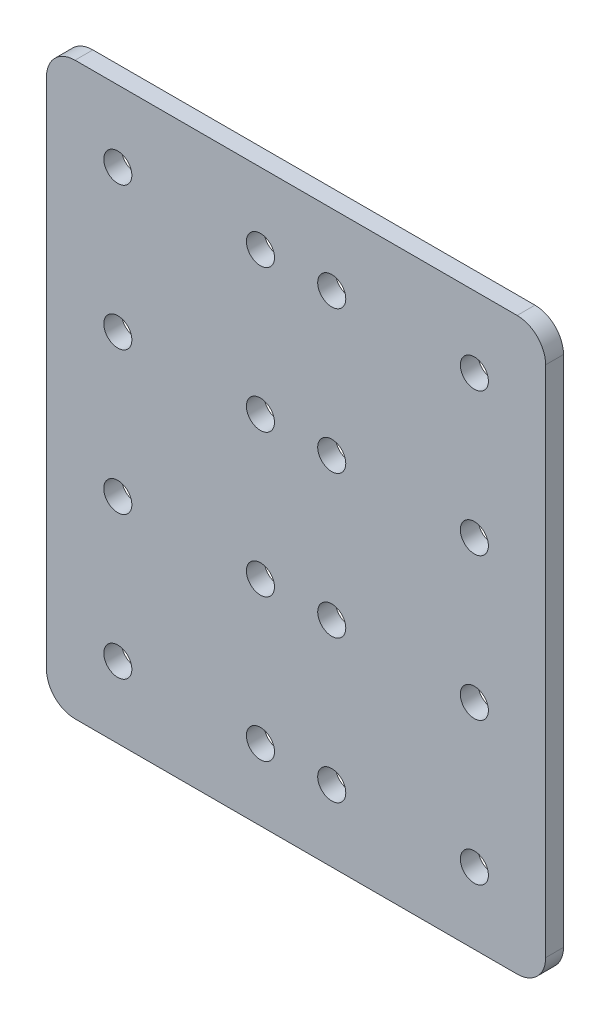
from build123d import *

# Parameters (mm, degrees)
SKETCH1_R           = 2.5
BOSS_EXTRUDE1_DEPTH = 3.175


with BuildPart() as part:
    # Sketch1 → Boss-Extrude1 (new body)
    with BuildSketch(Plane.XY):
        with BuildLine():
            Line((1176.02, 25.4), (1097.28, 25.4))
            ThreePointArc((1097.28, 25.4), (1093.687897552, 23.912102448), (1092.2, 20.32))
            Line((1092.2, 20.32), (1092.2, -71.12))
            ThreePointArc((1092.2, -71.12), (1093.687897552, -74.712102448), (1097.28, -76.2))
            Line((1097.28, -76.2), (1176.02, -76.2))
            ThreePointArc((1176.02, -76.2), (1179.612102448, -74.712102448), (1181.1, -71.12))
            Line((1181.1, -71.12), (1181.1, 20.32))
            ThreePointArc((1181.1, 20.32), (1179.612102448, 23.912102448), (1176.02, 25.4))
        make_face()
        with Locations((1143, 12.7)):
            Circle(SKETCH1_R, mode=Mode.SUBTRACT)
        with Locations((1168.4, 12.7)):
            Circle(SKETCH1_R, mode=Mode.SUBTRACT)
        with Locations((1168.4, -12.7)):
            Circle(SKETCH1_R, mode=Mode.SUBTRACT)
        with Locations((1168.4, -38.1)):
            Circle(SKETCH1_R, mode=Mode.SUBTRACT)
        with Locations((1168.4, -63.5)):
            Circle(SKETCH1_R, mode=Mode.SUBTRACT)
        with Locations((1143, -12.7)):
            Circle(SKETCH1_R, mode=Mode.SUBTRACT)
        with Locations((1143, -38.1)):
            Circle(SKETCH1_R, mode=Mode.SUBTRACT)
        with Locations((1143, -63.5)):
            Circle(SKETCH1_R, mode=Mode.SUBTRACT)
        with Locations(Location((1104.9, 12.7, 0), (0, 0, 180))):
            Circle(SKETCH1_R, mode=Mode.SUBTRACT)
        with Locations(Location((1104.9, -12.7, 0), (0, 0, 180))):
            Circle(SKETCH1_R, mode=Mode.SUBTRACT)
        with Locations(Location((1104.9, -38.1, 0), (0, 0, 180))):
            Circle(SKETCH1_R, mode=Mode.SUBTRACT)
        with Locations(Location((1104.9, -63.5, 0), (0, 0, 180))):
            Circle(SKETCH1_R, mode=Mode.SUBTRACT)
        with Locations(Location((1130.3, -63.5, 0), (0, 0, 180))):
            Circle(SKETCH1_R, mode=Mode.SUBTRACT)
        with Locations(Location((1130.3, -38.1, 0), (0, 0, 180))):
            Circle(SKETCH1_R, mode=Mode.SUBTRACT)
        with Locations(Location((1130.3, -12.7, 0), (0, 0, 180))):
            Circle(SKETCH1_R, mode=Mode.SUBTRACT)
        with Locations(Location((1130.3, 12.7, 0), (0, 0, 180))):
            Circle(SKETCH1_R, mode=Mode.SUBTRACT)
    extrude(amount=BOSS_EXTRUDE1_DEPTH)


solid = part.part
